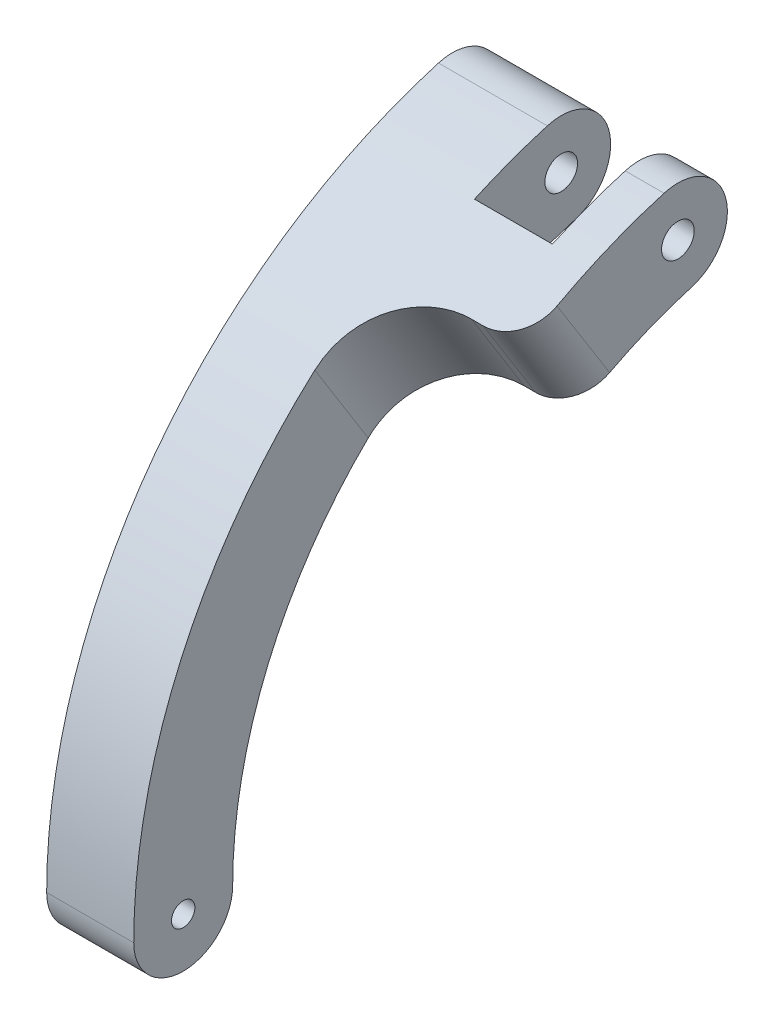
from build123d import *

# Parameters (mm, degrees)
ESQUISSE1_R             = 0.750000000000002
ESQUISSE1_R_2           = 1.05
BOSS_EXTRU_1_DEPTH      = 5.588
BOSS_EXTRU_2_DEPTH      = 8.889999999999999
ENL_V_MAT_EXTRU_1_DEPTH = 2.5
ESQUISSE4_R             = 1.05
ENL_V_MAT_EXTRU_2_DEPTH = 51.616470975365324
CONG_1_R                = 5.588
CONG_2_R                = 2.54


with BuildPart() as part:
    # Esquisse1 → Boss.-Extru.1 (new body)
    with BuildSketch(Plane(origin=(0, 0, 0), x_dir=(0, 0, -1), z_dir=(1, 0, 0))):
        with BuildLine():
            ThreePointArc((-28.574999999999996, 0), (-22.86, 17.144999999999996), (-8.00099999999999, 27.432000000000002))
            ThreePointArc((-8.00099999999999, 27.432000000000002), (-5.841999999999989, 31.369000000000003), (-9.778999999999986, 33.528))
            ThreePointArc((-9.778999999999986, 33.528), (-27.939999999999998, 20.955), (-34.925, 0))
            ThreePointArc((-34.925, 0), (-31.75, -3.174999999999997), (-28.574999999999996, 0))
        make_face()
        with Locations((-31.75, 0)):
            Circle(ESQUISSE1_R, mode=Mode.SUBTRACT)
        with Locations((-8.889999999999992, 30.480000000000004)):
            Circle(ESQUISSE1_R_2, mode=Mode.SUBTRACT)
    extrude(amount=BOSS_EXTRU_1_DEPTH)

    # Esquisse2 → Boss.-Extru.2 (add)
    with BuildSketch(Plane(origin=(5.588, 0, 0), x_dir=(0, 0, -1), z_dir=(1, 0, 0))):
        with BuildLine():
            Line((-15.468698222001095, 24.026027560057866), (-18.836262664685126, 29.410046477810756))
            ThreePointArc((-18.836262664685126, 29.410046477810756), (-14.455023336022604, 31.793205647670106), (-9.778999999999986, 33.528000000000006))
            ThreePointArc((-9.778999999999986, 33.528000000000006), (-5.8419999999999845, 31.369000000000003), (-8.000999999999987, 27.432))
            ThreePointArc((-8.000999999999987, 27.432), (-11.85777574941277, 25.9985341755384), (-15.468698222001095, 24.026027560057866))
        make_face()
    extrude(amount=BOSS_EXTRU_2_DEPTH)

    # Esquisse3 → Enlèv. mat.-Extru.1 (cut, symmetric)
    with BuildSketch(Plane(origin=(9.487780000000024, 4.74e-15, -3.69e-15), x_dir=(-1.3e-16, 0, -1), z_dir=(1, 2.5e-16, -1.3e-16))):
        with BuildLine():
            Line((-11.857775749412772, 25.9985341755384), (-14.455023336022602, 31.793205647670096))
            ThreePointArc((-14.455023336022602, 31.793205647670096), (-12.148018341439107, 32.74417925946624), (-9.778999999999993, 33.528))
            ThreePointArc((-9.778999999999993, 33.528), (-5.84199999999999, 31.368999999999996), (-8.000999999999994, 27.43199999999999))
            ThreePointArc((-8.000999999999994, 27.43199999999999), (-9.9552222292544, 26.78477506655896), (-11.857775749412772, 25.9985341755384))
        make_face()
    extrude(amount=ENL_V_MAT_EXTRU_1_DEPTH, both=True, mode=Mode.SUBTRACT)

    # Esquisse4 → Enlèv. mat.-Extru.2 (cut, through all)
    with BuildSketch(Plane.ZY):
        with Locations(Location((8.889999999999992, 30.480000000000004, 0), (0, 0, 90))):
            Circle(ESQUISSE4_R)
    extrude(amount=-ENL_V_MAT_EXTRU_2_DEPTH, mode=Mode.SUBTRACT)

    # Congé1
    cong_1_edges = [part.edges().sort_by_distance(p)[0] for p in [
        (5.588, 26.71803701893431, 17.152480443343112),
    ]]
    fillet(cong_1_edges, radius=CONG_1_R)

    # Congé2
    cong_2_edges = [part.edges().sort_by_distance(p)[0] for p in [
        (14.477999999999998, 26.71803701893431, 17.152480443343112),
    ]]
    fillet(cong_2_edges, radius=CONG_2_R)


solid = part.part
